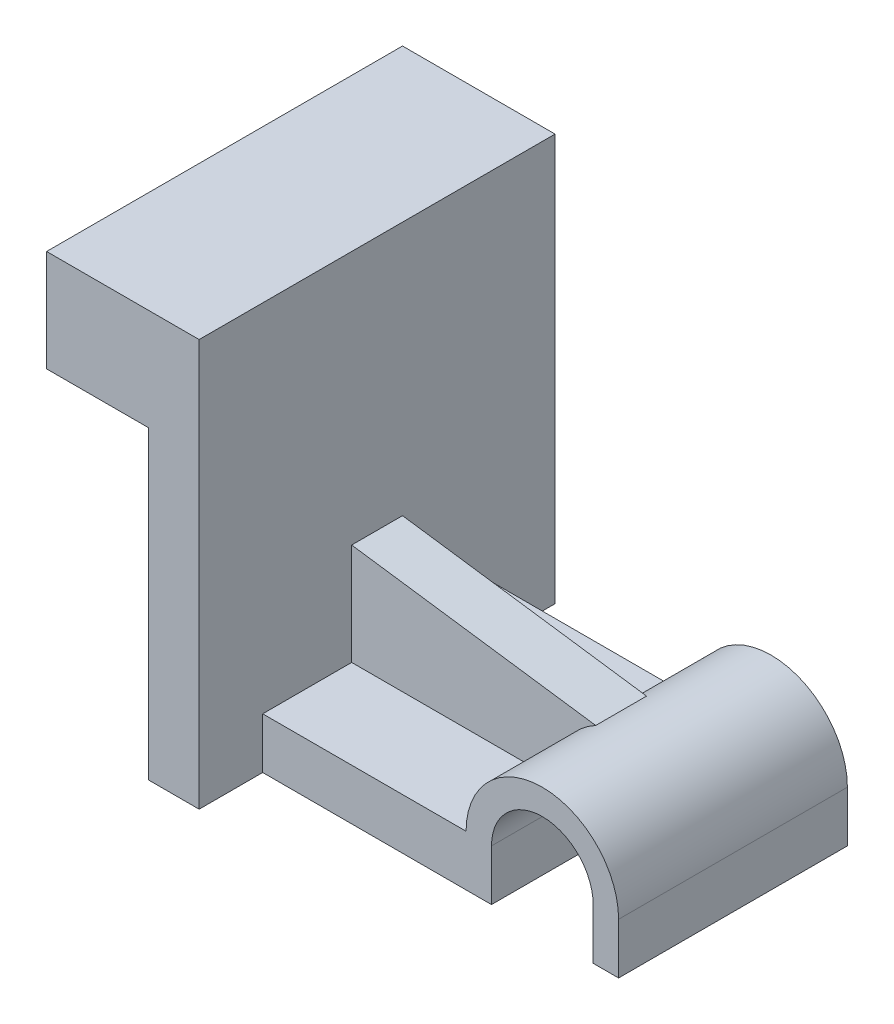
from build123d import *

# Parameters (mm, degrees)
EXTRUDE_1_DEPTH     = 45
SKETCH_2_W          = 70
SKETCH_2_H          = 80
EXTRUDE_2_DEPTH     = 30
SKETCH_3_W          = 70
SKETCH_3_H          = 60
CUT_EXTRUDE_1_DEPTH = 20
SKETCH_4_W          = 10
SKETCH_4_H          = 20
EXTRUDE_4_DEPTH     = 48
CUT_EXTRUDE_2_DEPTH = 125.222582488
CUT_EXTRUDE_3_DEPTH = 118.153745139


with BuildPart() as part:
    # 草圖1 → 填料-伸長1 (new body)
    with BuildSketch(Plane.XY):
        with BuildLine():
            Line((-15, 0), (-55, 0))
            Line((-55, 0), (-55, -10))
            Line((-55, -10), (-10, -10))
            Line((-10, -10), (-10, 0))
            ThreePointArc((-10, 0), (0, 10), (10, 0))
            Line((10, 0), (10, -10))
            Line((10, -10), (15, -10))
            Line((15, -10), (15, 0))
            ThreePointArc((15, 0), (0, 15), (-15, 0))
        make_face()
    extrude(amount=-EXTRUDE_1_DEPTH)

    # 草圖2 → 填料-伸長2 (add)
    with BuildSketch(Plane.ZY.offset(55)):
        with Locations((-22.5, 30)):
            Rectangle(SKETCH_2_W, SKETCH_2_H)
    extrude(amount=EXTRUDE_2_DEPTH)

    # 草圖3 → 除料-伸長1 (cut)
    with BuildSketch(Plane.ZY.offset(85)):
        with Locations((-22.5, 20)):
            Rectangle(SKETCH_3_W, SKETCH_3_H)
    extrude(amount=-CUT_EXTRUDE_1_DEPTH, mode=Mode.SUBTRACT)

    # 草圖4 → 填料-伸長4 (add)
    with BuildSketch(Plane(origin=(-55, 0, 0), x_dir=(0, 0, -1), z_dir=(1, 0, 0))):
        with Locations((22.5, 10)):
            Rectangle(SKETCH_4_W, SKETCH_4_H)
    extrude(amount=EXTRUDE_4_DEPTH)

    # 草圖6 → 除料-伸長2 (cut, through all)
    with BuildSketch(Plane.XY):
        with BuildLine():
            Line((10, 0), (10, -10))
            Line((10, -10), (-10, -10))
            Line((-10, -10), (-10, 0))
            ThreePointArc((-10, 0), (0, 10), (10, 0))
        make_face()
    extrude(amount=-CUT_EXTRUDE_2_DEPTH, mode=Mode.SUBTRACT)

    # 草圖7 → 除料-伸長3 (cut, through all)
    with BuildSketch(Plane.XY.offset(-17.5)):
        Polygon((-7, 13.266499161), (-55, 20), (-7, 20), align=None)
    extrude(amount=-CUT_EXTRUDE_3_DEPTH, mode=Mode.SUBTRACT)


solid = part.part
